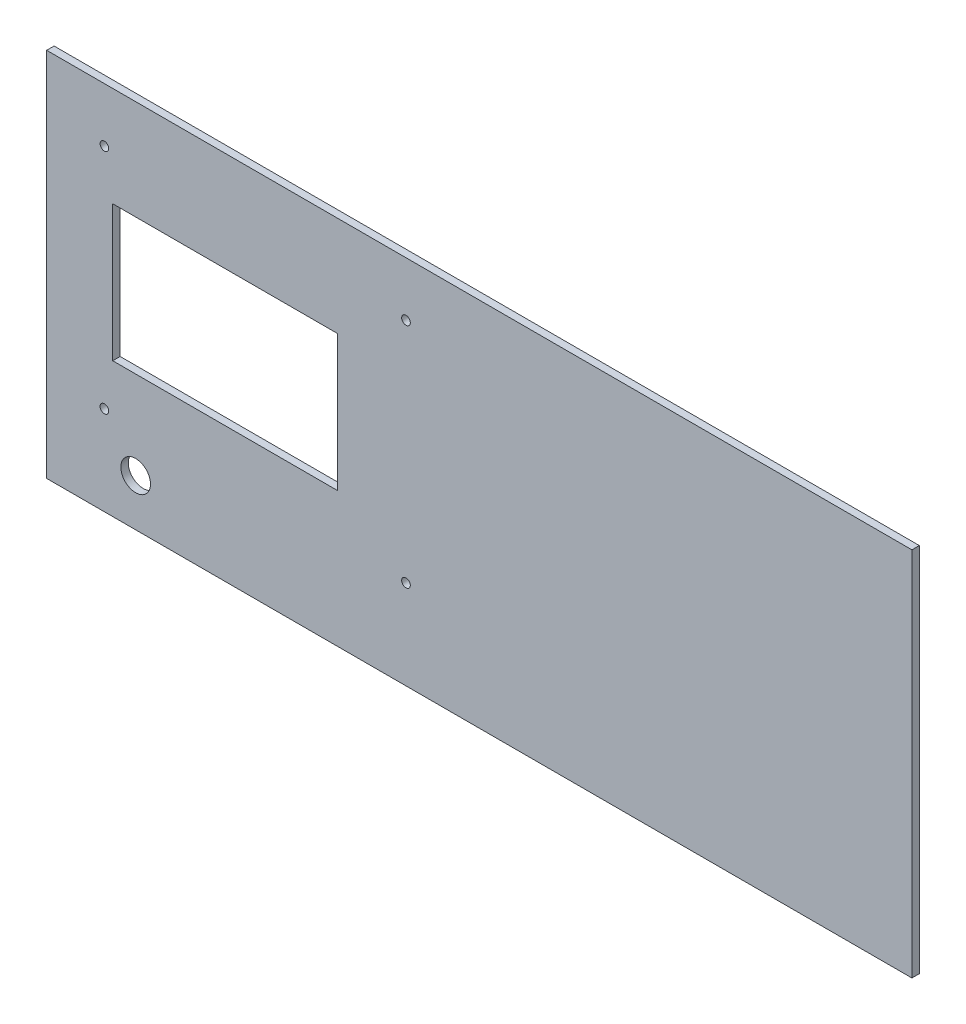
from build123d import *

# Parameters (mm, degrees)
SKETCH_1_W      = 350
SKETCH_1_H      = 150
SKETCH_1_R      = 1.75
SKETCH_1_R_2    = 6
SKETCH_1_W_2    = 91
SKETCH_1_H_2    = 55
EXTRUDE_1_DEPTH = 3


with BuildPart() as part:
    # 草图1 → 凸台-拉伸1 (new body)
    with BuildSketch(Plane.XY):
        with Locations((0, 75)):
            Rectangle(SKETCH_1_W, SKETCH_1_H)
        with Locations((-151.652414134, 128.095526692)):
            Circle(SKETCH_1_R, mode=Mode.SUBTRACT)
        with Locations((-29.652414134, 128.095526692)):
            Circle(SKETCH_1_R, mode=Mode.SUBTRACT)
        with Locations((-29.652414134, 36.095526692)):
            Circle(SKETCH_1_R, mode=Mode.SUBTRACT)
        with Locations((-151.652414134, 36.095526692)):
            Circle(SKETCH_1_R, mode=Mode.SUBTRACT)
        with Locations((-139, 19)):
            Circle(SKETCH_1_R_2, mode=Mode.SUBTRACT)
        with Locations((-102.777414134, 82.095526692)):
            Rectangle(SKETCH_1_W_2, SKETCH_1_H_2, mode=Mode.SUBTRACT)
    extrude(amount=EXTRUDE_1_DEPTH)


solid = part.part
